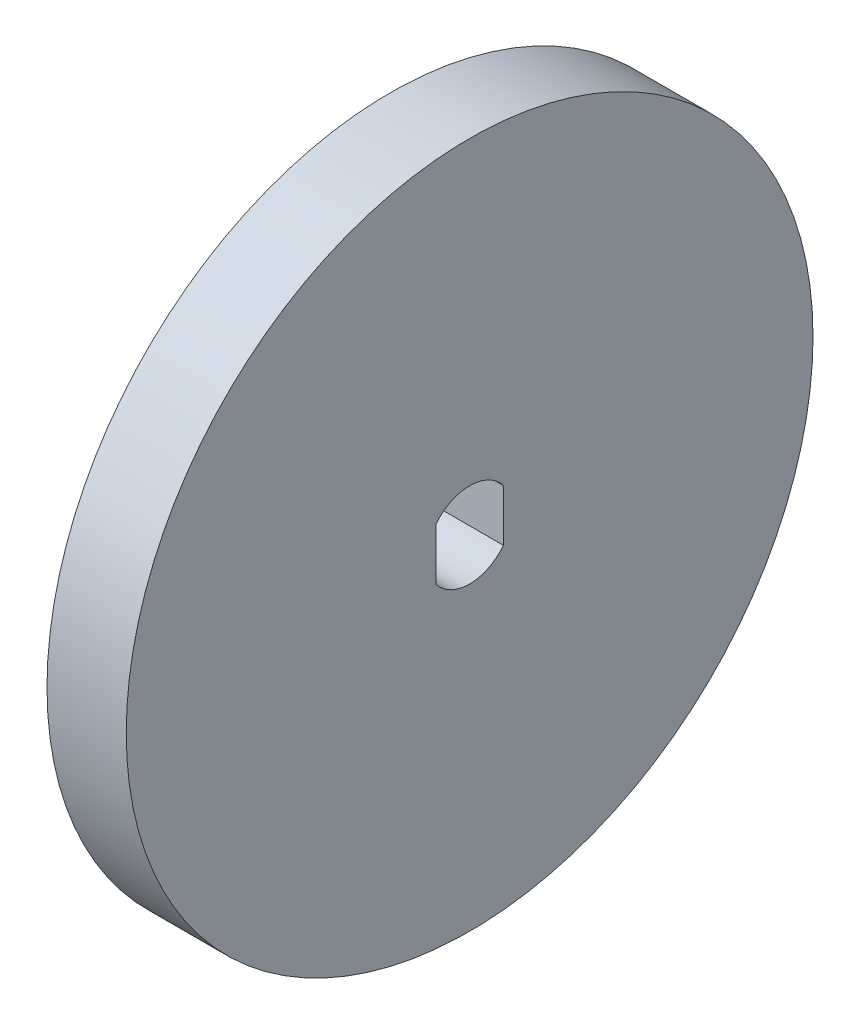
from build123d import *

# Parameters (mm, degrees)
SKETCH1_R  = 11.7
BASE_DEPTH = 2.7


with BuildPart() as part:
    # Sketch1 → Base (new body)
    with BuildSketch(Plane(origin=(0, 0, 0), x_dir=(0, 0, -1), z_dir=(1, 0, 0))):
        with Locations(Location((0, 0, 0), (0, 0, 180))):
            Circle(SKETCH1_R)
        with BuildLine():
            Line((1.15, 0.883176087), (1.15, -0.883176087))
            ThreePointArc((1.15, -0.883176087), (0, -1.45), (-1.15, -0.883176087))
            Line((-1.15, -0.883176087), (-1.15, 0.883176087))
            ThreePointArc((-1.15, 0.883176087), (0, 1.45), (1.15, 0.883176087))
        make_face(mode=Mode.SUBTRACT)
    extrude(amount=BASE_DEPTH)


solid = part.part
